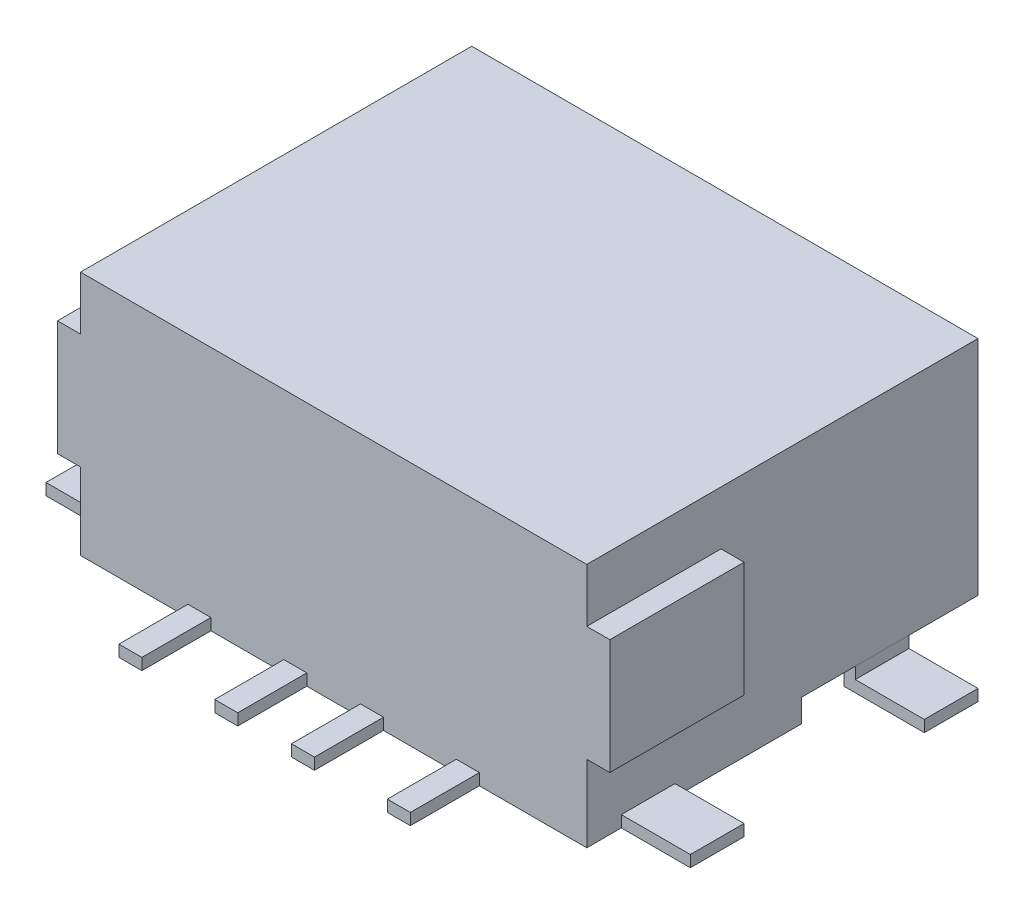
from build123d import *

# Parameters (mm, degrees)
SKETCH_1_W          = 13.2
SKETCH_1_H          = 10.2
EXTRUDE_1_DEPTH     = 5.8
SKETCH_2_W          = 12.4
SKETCH_2_H          = 5
CUT_EXTRUDE_1_DEPTH = 9.8
SKETCH_3_W          = 10.8
SKETCH_3_H          = 1.5
EXTRUDE_2_DEPTH     = 9.8
SKETCH_4_W          = 3.5
SKETCH_4_H          = 3
EXTRUDE_3_DEPTH     = 0.6
EXTRUDE_START       = -13.2
SKETCH_4_2_W        = 3.5
SKETCH_4_2_H        = 3
EXTRUDE_4_DEPTH     = 0.6
SKETCH_5_W          = 13.2
SKETCH_5_H          = 5.6
EXTRUDE_5_DEPTH     = 0.6
SKETCH_6_R          = 0.75
EXTRUDE_6_DEPTH     = 0.4
SKETCH_7_W          = 1.8
SKETCH_7_H          = 1.4
EXTRUDE_7_DEPTH     = 0.3
SKETCH_8_W          = 1.4
SKETCH_8_H          = 0.6
EXTRUDE_9_DEPTH     = 0.3
EXTRUDE_START_2     = 13.2
SKETCH_8_2_W        = 1.4
SKETCH_8_2_H        = 0.6
EXTRUDE_10_DEPTH    = 0.3
SKETCH_9_W          = 0.6
SKETCH_9_H          = 0.3
EXTRUDE_11_DEPTH    = 1.8


with BuildPart() as part:
    # 草图1 → 凸台-拉伸1 (new body)
    with BuildSketch(Plane(origin=(0, 0, 0), x_dir=(1, 0, 0), z_dir=(0, 1, 0))):
        Rectangle(SKETCH_1_W, SKETCH_1_H)
    extrude(amount=EXTRUDE_1_DEPTH)

    # 草图2 → 切除-拉伸1 (cut)
    with BuildSketch(Plane(origin=(0, 0, -5.1), x_dir=(-1, 0, 0), z_dir=(0, 0, -1))):
        with Locations((0, 2.9)):
            Rectangle(SKETCH_2_W, SKETCH_2_H)
    extrude(amount=-CUT_EXTRUDE_1_DEPTH, mode=Mode.SUBTRACT)

    # 草图3 → 凸台-拉伸2 (add)
    with BuildSketch(Plane(origin=(0, 0, 4.7), x_dir=(-1, 0, 0), z_dir=(0, 0, -1))):
        with Locations((0, 3.65)):
            Rectangle(SKETCH_3_W, SKETCH_3_H)
    extrude(amount=EXTRUDE_2_DEPTH)

    # 草图4 → 凸台-拉伸3 (add)
    with BuildSketch(Plane(origin=(6.6, 0, 0), x_dir=(0, 0, -1), z_dir=(1, 0, 0))):
        with Locations((-3.35, 2.9)):
            Rectangle(SKETCH_4_W, SKETCH_4_H)
    extrude(amount=EXTRUDE_3_DEPTH)

    # 草图4<2> → 凸台-拉伸4 (add)
    with BuildSketch(Plane(origin=(6.6, 0, 0), x_dir=(0, 0, -1), z_dir=(1, 0, 0)).offset(EXTRUDE_START)):
        with Locations((-3.35, 2.9)):
            Rectangle(SKETCH_4_2_W, SKETCH_4_2_H)
    extrude(amount=-EXTRUDE_4_DEPTH)

    # 草图5 → 凸台-拉伸5 (add)
    with BuildSketch(Plane.XZ):
        with Locations((0, 2.3)):
            Rectangle(SKETCH_5_W, SKETCH_5_H)
    extrude(amount=EXTRUDE_5_DEPTH)

    # 草图6 → 凸台-拉伸6 (add)
    with BuildSketch(Plane.XZ.offset(0.6)):
        with Locations(Location((-2.45, 3.45, 0), (0, 0, 270))):
            Circle(SKETCH_6_R)
        with Locations(Location((2.45, 3.45, 0), (0, 0, 270))):
            Circle(SKETCH_6_R)
    extrude(amount=EXTRUDE_6_DEPTH)

    # 草图7 → 凸台-拉伸7 (add)
    with BuildSketch(Plane.XZ.offset(0.6)):
        with Locations((-7.5, 3.5)):
            Rectangle(SKETCH_7_W, SKETCH_7_H)
        with Locations((7.5, 3.5)):
            Rectangle(SKETCH_7_W, SKETCH_7_H)
        with Locations((-7.5, -2.6)):
            Rectangle(SKETCH_7_W, SKETCH_7_H)
        with Locations((7.5, -2.6)):
            Rectangle(SKETCH_7_W, SKETCH_7_H)
    extrude(amount=-EXTRUDE_7_DEPTH)


with BuildPart() as extrude_7_piece_1:
    # of the separate pieces the step leaves, piece 1, a body of its own (extrude_7_pieces)
    add(part.part.solids().sort_by_distance((-6.6, 1.4, 5.1))[0])



with BuildPart() as extrude_7_piece_2:
    # of the separate pieces the step leaves, piece 2, a body of its own (extrude_7_pieces)
    add(part.part.solids().sort_by_distance((6.6, -0.6, -1.9))[0])

    # 草图8 → 凸台-拉伸9 (add)
    with BuildSketch(Plane.ZY.offset(-6.6)):
        with Locations((-2.6, -0.3)):
            Rectangle(SKETCH_8_W, SKETCH_8_H)
    extrude(amount=EXTRUDE_9_DEPTH)


with BuildPart() as extrude_7_piece_3:
    # of the separate pieces the step leaves, piece 3, a body of its own (extrude_7_pieces)
    add(part.part.solids().sort_by_distance((-6.6, -0.6, -1.9))[0])


with BuildPart() as extrude_7_piece_1_1:
    add(extrude_7_piece_1.part)

    add(extrude_7_piece_3.part)  # 凸台-拉伸10 merges 凸台-拉伸7 piece 3
    # 草图8<2> → 凸台-拉伸10 (add)
    with BuildSketch(Plane.ZY.offset(-6.6).offset(EXTRUDE_START_2)):
        with Locations((-2.6, -0.3)):
            Rectangle(SKETCH_8_2_W, SKETCH_8_2_H)
    extrude(amount=-EXTRUDE_10_DEPTH)

    # 草图9 → 凸台-拉伸11 (add)
    with BuildSketch(Plane.XY.offset(5.1)):
        with Locations((-3.5, -0.45)):
            Rectangle(SKETCH_9_W, SKETCH_9_H)
        with Locations((-1, -0.45)):
            Rectangle(SKETCH_9_W, SKETCH_9_H)
        with Locations((1, -0.45)):
            Rectangle(SKETCH_9_W, SKETCH_9_H)
        with Locations((3.5, -0.45)):
            Rectangle(SKETCH_9_W, SKETCH_9_H)
    extrude(amount=EXTRUDE_11_DEPTH)


solid = Compound([extrude_7_piece_2.part, extrude_7_piece_1_1.part])
